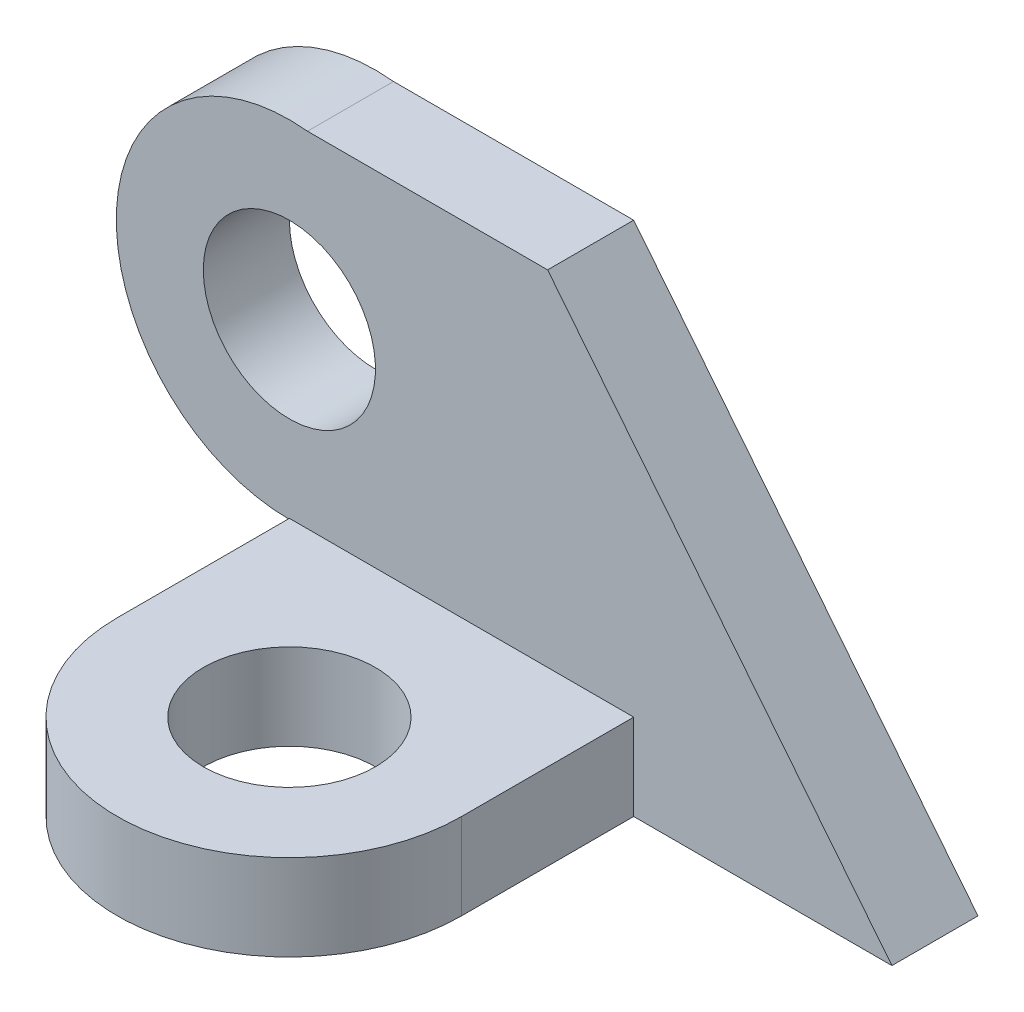
from build123d import *

# Parameters (mm, degrees)
SKETCH1_R           = 10
BOSS_EXTRUDE1_DEPTH = 10
BOSS_EXTRUDE2_DEPTH = 10


with BuildPart() as part:
    # Sketch1 → Boss-Extrude1 (new body)
    with BuildSketch(Plane(origin=(0, 0, 0), x_dir=(1, 0, 0), z_dir=(0, 1, 0))):
        with BuildLine():
            Line((-20, 0), (-20, 20))
            Line((-20, 20), (20, 20))
            Line((20, 20), (20, 0))
            ThreePointArc((20, 0), (0, -20), (-20, 0))
        make_face()
        with Locations(Location((0, 0, 0), (0, 0, 270))):
            Circle(SKETCH1_R, mode=Mode.SUBTRACT)
    extrude(amount=BOSS_EXTRUDE1_DEPTH)


with BuildPart() as body_2:
    # Sketch2 → Boss-Extrude2 (new body)
    with BuildSketch(Plane(origin=(0, 0, -20), x_dir=(-1, 0, 0), z_dir=(0, 0, -1))):
        with BuildLine():
            Line((20, 20), (20, 10))
            Line((20, 10), (20, 9.890171032))
            ThreePointArc((20, 9.890171032), (40.082352955, 31.050866726), (17.901138141, 50))
            Line((17.901138141, 50), (20, 50))
            Line((20, 50), (20, 40))
            ThreePointArc((20, 40), (27.071067812, 37.071067812), (30, 30))
            ThreePointArc((30, 30), (27.071067812, 22.928932188), (20, 20))
        make_face()
        with BuildLine():
            Line((-20, 10), (20, 10))
            Line((20, 10), (20, 20))
            ThreePointArc((20, 20), (10, 30), (20, 40))
            Line((20, 40), (20, 50))
            Line((20, 50), (17.901138141, 50))
            Line((17.901138141, 50), (-10, 50))
            Line((-10, 50), (-50, 0))
            Line((-50, 0), (-20, 0))
            Line((-20, 0), (-20, 10))
        make_face()
    extrude(amount=BOSS_EXTRUDE2_DEPTH)


solid = Compound([part.part, body_2.part])
